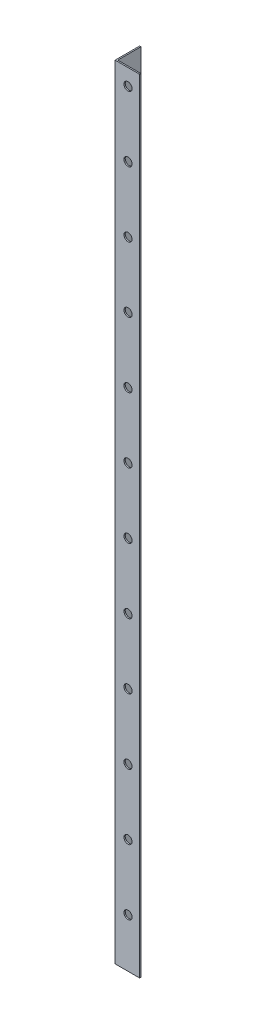
from build123d import *

# Parameters (mm, degrees)
BOSS_EXTRUDE1_DEPTH = 304.8
SKETCH3_R           = 1.5875
CUT_EXTRUDE1_DEPTH  = 306.082074062
LPATTERN1_COUNT     = 12
LPATTERN1_PITCH     = 25.4
SKETCH4_R           = 1.5875
CUT_EXTRUDE2_DEPTH  = 306.082074062
LPATTERN2_COUNT     = 12
LPATTERN2_PITCH     = 25.4


with BuildPart() as part:
    # Sketch2 → Boss-Extrude1 (new body)
    with BuildSketch(Plane(origin=(0, 0, 0), x_dir=(1, 0, 0), z_dir=(0, 1, 0))):
        Polygon((0, 0), (9.525, 0), (9.525, 0.508), (0.508, 0.508), (0.508, 9.525), (0, 9.525), align=None)
    extrude(amount=BOSS_EXTRUDE1_DEPTH)

    # Sketch3 → Cut-Extrude1 (cut, through all)
    with BuildSketch(Plane(origin=(0, 0, -0.508), x_dir=(-1, 0, 0), z_dir=(0, 0, -1))):
        with Locations((-5.0165, 298.45)):
            Circle(SKETCH3_R)
    cut_extrude1 = extrude(amount=-CUT_EXTRUDE1_DEPTH, mode=Mode.SUBTRACT)

    # LPattern1: Cut-Extrude1 ×12
    with Locations(*[(0, -i * LPATTERN1_PITCH, 0) for i in range(1, LPATTERN1_COUNT)]):
        add(cut_extrude1, mode=Mode.SUBTRACT)

    # Sketch4 → Cut-Extrude2 (cut, through all)
    with BuildSketch(Plane(origin=(0.508, 0, 0), x_dir=(0, 0, -1), z_dir=(1, 0, 0))):
        with Locations((5.0165, 285.75)):
            Circle(SKETCH4_R)
    cut_extrude2 = extrude(amount=-CUT_EXTRUDE2_DEPTH, mode=Mode.SUBTRACT)

    # LPattern2: Cut-Extrude2 ×12
    with Locations(*[(0, -i * LPATTERN2_PITCH, 0) for i in range(1, LPATTERN2_COUNT)]):
        add(cut_extrude2, mode=Mode.SUBTRACT)


solid = part.part
